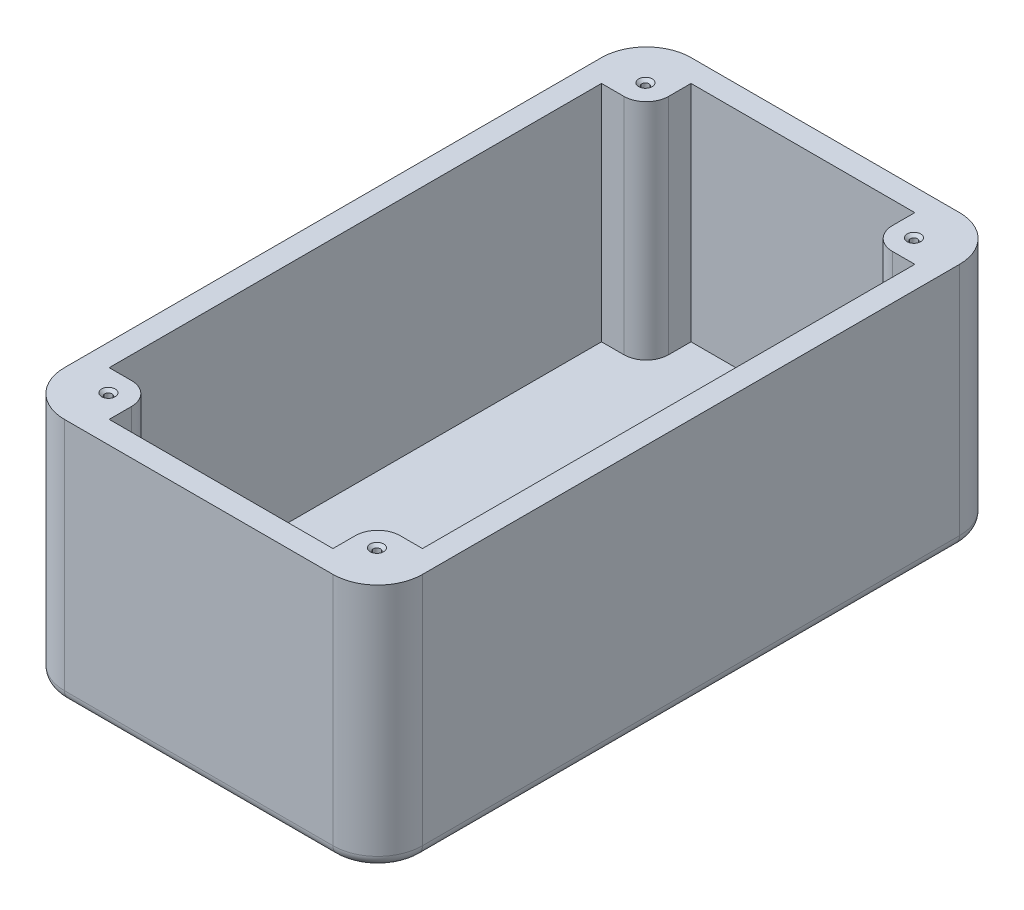
from build123d import *

# Parameters (mm, degrees)
SKETCH2_W                                         = 80
SKETCH2_H                                         = 140
BOSS_EXTRUDE1_DEPTH                               = 50
SHELL1_T                                          = -5
SKETCH3_W                                         = 80
SKETCH3_H                                         = 140
SKETCH3_W_2                                       = 70
SKETCH3_H_2                                       = 130
BOSS_EXTRUDE2_DEPTH                               = 5
BOSS_EXTRUDE3_REACH                               = 99.596
CSK_FOR_0_FLAT_HEAD_MACHINE_SCREW_100_D           = 1.6129
CSK_FOR_0_FLAT_HEAD_MACHINE_SCREW_100_DEPTH       = 10
CSK_FOR_0_FLAT_HEAD_MACHINE_SCREW_100_CSINK_D     = 3.0226
CSK_FOR_0_FLAT_HEAD_MACHINE_SCREW_100_CSINK_ANGLE = 100
CSK_FOR_0_FLAT_HEAD_MACHINE_SCREW_100_TIP         = 0.484564046
FILLET1_R                                         = 10
FILLET2_R                                         = 2.5


with BuildPart() as part:
    # Sketch2 → Boss-Extrude1 (new body)
    with BuildSketch(Plane(origin=(0, 0, 0), x_dir=(1, 0, 0), z_dir=(0, 1, 0))):
        Rectangle(SKETCH2_W, SKETCH2_H)
    extrude(amount=BOSS_EXTRUDE1_DEPTH)

    # Shell1
    shell1_openings = [part.faces().sort_by_distance(p)[0] for p in [
        (0, 50, 0),
    ]]
    offset(amount=SHELL1_T, openings=shell1_openings, kind=Kind.INTERSECTION)

    # Sketch3 → Boss-Extrude2 (add)
    with BuildSketch(Plane(origin=(0, 50, 0), x_dir=(1, 0, 0), z_dir=(0, 1, 0))):
        Rectangle(SKETCH3_W, SKETCH3_H)
        Rectangle(SKETCH3_W_2, SKETCH3_H_2, mode=Mode.SUBTRACT)
    extrude(amount=BOSS_EXTRUDE2_DEPTH)

    # Sketch4 → Boss-Extrude3 (add, up to next)
    with BuildSketch(Plane(origin=(0, 55, 0), x_dir=(1, 0, 0), z_dir=(0, 1, 0)), mode=Mode.PRIVATE) as boss_extrude3_sk1:
        with BuildLine():
            Line((-35, -65), (-35, -55))
            Line((-35, -55), (-30, -55))
            ThreePointArc((-30, -55), (-26.464466094, -56.464466094), (-25, -60))
            Line((-25, -60), (-25, -65))
            Line((-25, -65), (-35, -65))
        make_face()
    boss_extrude3_tool1 = extrude(boss_extrude3_sk1.sketch, amount=-BOSS_EXTRUDE3_REACH, mode=Mode.PRIVATE) - part.part
    # Sketch4 → Boss-Extrude3 (add, up to next)
    with BuildSketch(Plane(origin=(0, 55, 0), x_dir=(1, 0, 0), z_dir=(0, 1, 0)), mode=Mode.PRIVATE) as boss_extrude3_sk2:
        with BuildLine():
            Line((30, -55), (35, -55))
            Line((35, -55), (35, -65))
            Line((35, -65), (25, -65))
            Line((25, -65), (25, -60))
            ThreePointArc((25, -60), (26.464466094, -56.464466094), (30, -55))
        make_face()
    boss_extrude3_tool2 = extrude(boss_extrude3_sk2.sketch, amount=-BOSS_EXTRUDE3_REACH, mode=Mode.PRIVATE) - part.part
    # Sketch4 → Boss-Extrude3 (add, up to next)
    with BuildSketch(Plane(origin=(0, 55, 0), x_dir=(1, 0, 0), z_dir=(0, 1, 0)), mode=Mode.PRIVATE) as boss_extrude3_sk3:
        with BuildLine():
            Line((25, 60), (25, 65))
            Line((25, 65), (35, 65))
            Line((35, 65), (35, 55))
            Line((35, 55), (30, 55))
            ThreePointArc((30, 55), (26.464466094, 56.464466094), (25, 60))
        make_face()
    boss_extrude3_tool3 = extrude(boss_extrude3_sk3.sketch, amount=-BOSS_EXTRUDE3_REACH, mode=Mode.PRIVATE) - part.part
    # Sketch4 → Boss-Extrude3 (add, up to next)
    with BuildSketch(Plane(origin=(0, 55, 0), x_dir=(1, 0, 0), z_dir=(0, 1, 0)), mode=Mode.PRIVATE) as boss_extrude3_sk4:
        with BuildLine():
            Line((-30, 55), (-35, 55))
            Line((-35, 55), (-35, 65))
            Line((-35, 65), (-25, 65))
            Line((-25, 65), (-25, 60))
            ThreePointArc((-25, 60), (-26.464466094, 56.464466094), (-30, 55))
        make_face()
    boss_extrude3_tool4 = extrude(boss_extrude3_sk4.sketch, amount=-BOSS_EXTRUDE3_REACH, mode=Mode.PRIVATE) - part.part
    add(boss_extrude3_tool1.solids().sort_by_distance((-30.220144, 55, 60.220144))[0])
    add(boss_extrude3_tool2.solids().sort_by_distance((30.220144, 55, 60.220144))[0])
    add(boss_extrude3_tool3.solids().sort_by_distance((30.220144, 55, -60.220144))[0])
    add(boss_extrude3_tool4.solids().sort_by_distance((-30.220144, 55, -60.220144))[0])

    # CSK for #0 Flat Head Machine Screw (100)1
    with Locations(Plane(origin=(0, 55, 0), x_dir=(1, 0, 0), z_dir=(0, 1, 0))):
        with Locations((-30.216332876, -59.957909435), (29.772350977, -59.957909435), (29.772350977, 60.028429813), (-30.216332876, 60.028429813)):
            CounterSinkHole(CSK_FOR_0_FLAT_HEAD_MACHINE_SCREW_100_D / 2, CSK_FOR_0_FLAT_HEAD_MACHINE_SCREW_100_CSINK_D / 2, depth=CSK_FOR_0_FLAT_HEAD_MACHINE_SCREW_100_DEPTH, counter_sink_angle=CSK_FOR_0_FLAT_HEAD_MACHINE_SCREW_100_CSINK_ANGLE)
            with Locations((0, 0, -(CSK_FOR_0_FLAT_HEAD_MACHINE_SCREW_100_DEPTH + CSK_FOR_0_FLAT_HEAD_MACHINE_SCREW_100_TIP / 2))):  # 118° drill point
                Cone(0, CSK_FOR_0_FLAT_HEAD_MACHINE_SCREW_100_D / 2, CSK_FOR_0_FLAT_HEAD_MACHINE_SCREW_100_TIP, mode=Mode.SUBTRACT)

    # Fillet1
    fillet1_edges = [part.edges().sort_by_distance(p)[0] for p in [
        (40, 27.5, 70),
        (-40, 27.5, 70),
        (-40, 27.5, -70),
        (40, 27.5, -70),
    ]]
    fillet(fillet1_edges, radius=FILLET1_R)

    # Fillet2
    fillet2_edges = [part.edges().sort_by_distance(p)[0] for p in [
        (-40, 0, 0),
        (40, 0, 0),
        (0, 0, 70),
        (0, 0, -70),
        (37.071067812, 0, 67.071067812),
        (-37.071067812, 0, 67.071067812),
        (37.071067812, 0, -67.071067812),
        (-37.071067812, 0, -67.071067812),
    ]]
    fillet(fillet2_edges, radius=FILLET2_R)


solid = part.part
